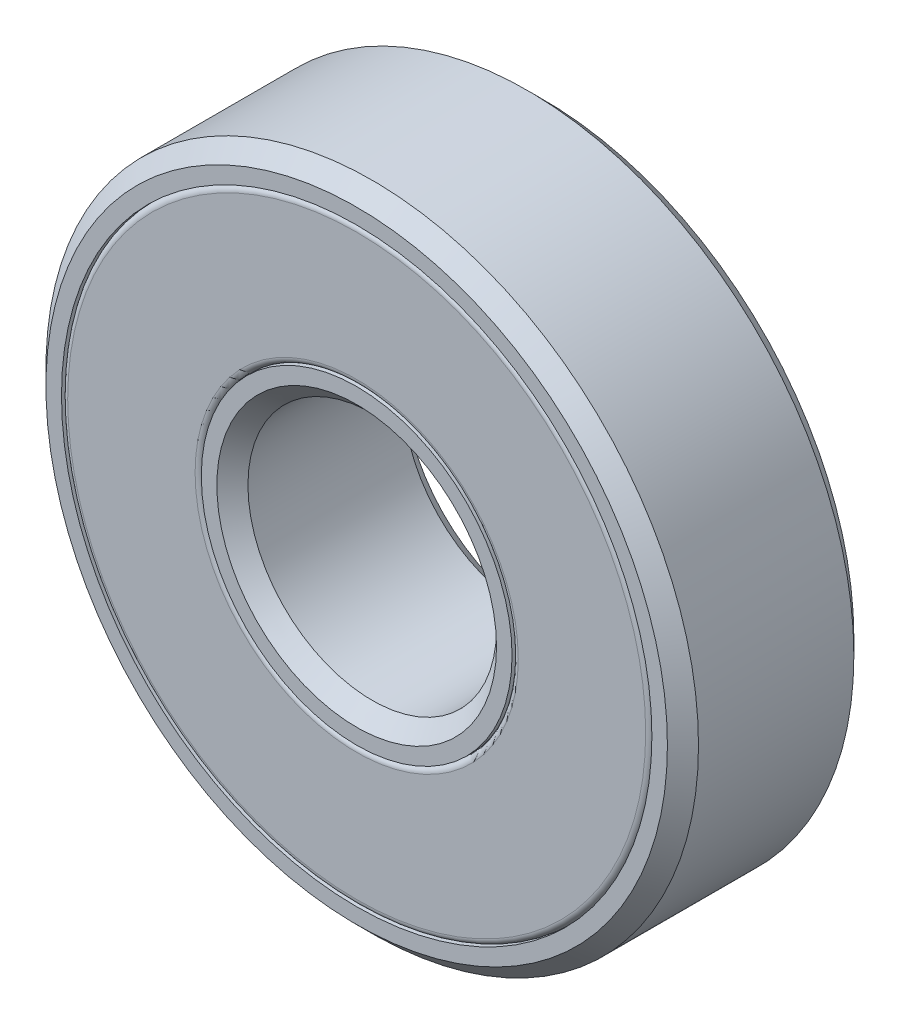
from build123d import *

# Parameters (mm, degrees)
SKETCH1_R             = 5
SKETCH1_R_2           = 4
BOSS_EXTRUDE1_DEPTH   = 6
SKETCH1_R_3           = 10.5
SKETCH1_R_4           = 9.5
BOSS_EXTRUDE1_2_DEPTH = 6
SKETCH2_R             = 9.5
SKETCH2_R_2           = 5
BOSS_EXTRUDE2_DEPTH   = 6
CHAMFER1_SIZE         = 0.5
CHAMFER2_SIZE         = 0.5
FILLET1_R             = 0.2


with BuildPart() as part:
    # Sketch1 → Boss-Extrude1 (new body)
    with BuildSketch(Plane.XY):
        Circle(SKETCH1_R)
        Circle(SKETCH1_R_2, mode=Mode.SUBTRACT)
    extrude(amount=BOSS_EXTRUDE1_DEPTH)

    # Chamfer2
    chamfer2_edges = [part.edges().sort_by_distance(p)[0] for p in [
        (-4, 0, 0),
        (-4, 0, 6),
    ]]
    chamfer(chamfer2_edges, length=CHAMFER2_SIZE)


with BuildPart() as body_2:
    # Sketch1 → Boss-Extrude1 2 (new body)
    with BuildSketch(Plane.XY):
        Circle(SKETCH1_R_3)
        Circle(SKETCH1_R_4, mode=Mode.SUBTRACT)
    extrude(amount=BOSS_EXTRUDE1_2_DEPTH)

    # Chamfer1
    chamfer1_edges = [body_2.edges().sort_by_distance(p)[0] for p in [
        (-10.5, 0, 0),
        (-10.5, 0, 6),
    ]]
    chamfer(chamfer1_edges, length=CHAMFER1_SIZE)


with BuildPart() as body_3:
    # Sketch2 → Boss-Extrude2 (new body)
    with BuildSketch(Plane.XY):
        Circle(SKETCH2_R)
        Circle(SKETCH2_R_2, mode=Mode.SUBTRACT)
    extrude(amount=BOSS_EXTRUDE2_DEPTH)

    # Fillet1
    fillet1_edges = [body_3.edges().sort_by_distance(p)[0] for p in [
        (-9.5, 0, 0),
        (-9.5, 0, 6),
        (-5, 0, 0),
        (-5, 0, 6),
    ]]
    fillet(fillet1_edges, radius=FILLET1_R)


solid = Compound([part.part, body_2.part, body_3.part])
